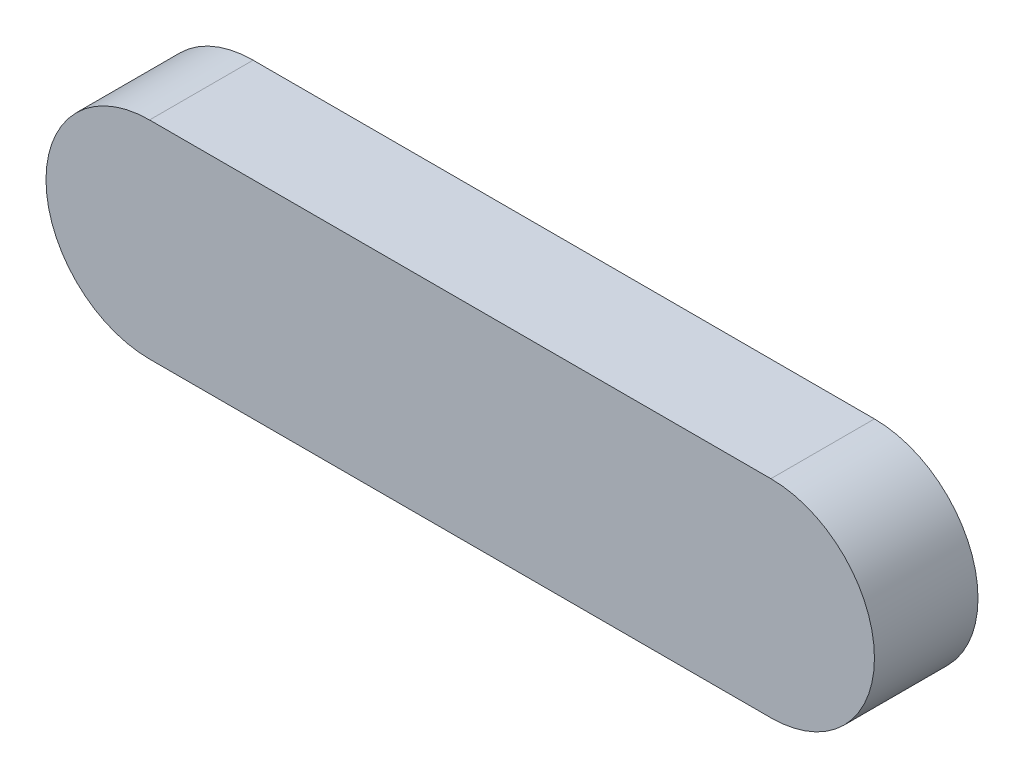
from build123d import *

# Parameters (mm, degrees)
EXTRUDE_1_DEPTH = 10


with BuildPart() as part:
    # 草图1 → 凸台-拉伸1 (new body)
    with BuildSketch(Plane.XY):
        with BuildLine():
            Line((0, 10), (60, 10))
            ThreePointArc((60, 10), (70, 0), (60, -10))
            Line((60, -10), (0, -10))
            ThreePointArc((0, -10), (-10, 0), (0, 10))
        make_face()
    extrude(amount=EXTRUDE_1_DEPTH)


solid = part.part
